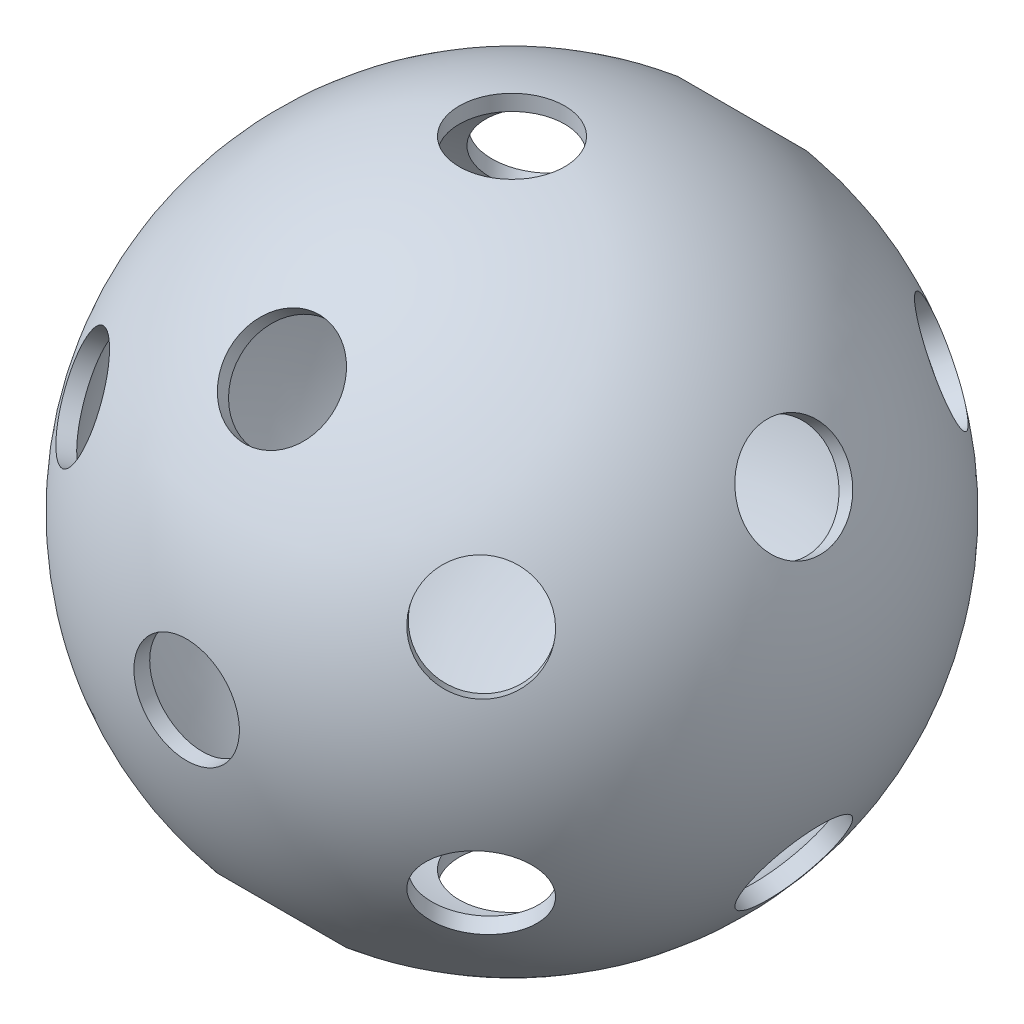
from build123d import *

# Parameters (mm, degrees)
SKETCH2_R                     = 10.16
CUT_EXTRUDE1_DEPTH            = 110.985226281
CIRPATTERN29_COUNT            = 8
CIRPATTERN30_COPY_1_SKETCH_R  = 10.16
CIRPATTERN30_COPY_1_DEPTH     = 110.985226281
CIRPATTERN30_COPY_2_SKETCH_R  = 10.16
CIRPATTERN30_COPY_2_DEPTH     = 110.985226281
CIRPATTERN30_COPY_3_SKETCH_R  = 10.16
CIRPATTERN30_COPY_3_DEPTH     = 110.985226281
CIRPATTERN30_COPY_4_SKETCH_R  = 10.16
CIRPATTERN30_COPY_4_DEPTH     = 110.985226281
CIRPATTERN30_COPY_5_SKETCH_R  = 10.16
CIRPATTERN30_COPY_5_DEPTH     = 110.985226281
CIRPATTERN30_COPY_6_SKETCH_R  = 10.16
CIRPATTERN30_COPY_6_DEPTH     = 110.985226281
CIRPATTERN30_COPY_7_SKETCH_R  = 10.16
CIRPATTERN30_COPY_7_DEPTH     = 110.985226281
CIRPATTERN30_COPY_8_SKETCH_R  = 10.16
CIRPATTERN30_COPY_8_DEPTH     = 110.985226281
CIRPATTERN30_COPY_9_SKETCH_R  = 10.16
CIRPATTERN30_COPY_9_DEPTH     = 110.985226281
CIRPATTERN30_COPY_10_SKETCH_R = 10.16
CIRPATTERN30_COPY_10_DEPTH    = 110.985226281
CIRPATTERN30_COPY_11_SKETCH_R = 10.16
CIRPATTERN30_COPY_11_DEPTH    = 110.985226281
CIRPATTERN30_COPY_12_SKETCH_R = 10.16
CIRPATTERN30_COPY_12_DEPTH    = 110.985226281
CIRPATTERN30_COPY_13_SKETCH_R = 10.16
CIRPATTERN30_COPY_13_DEPTH    = 110.985226281
CIRPATTERN30_COPY_14_SKETCH_R = 10.16
CIRPATTERN30_COPY_14_DEPTH    = 110.985226281
CIRPATTERN30_COPY_15_SKETCH_R = 10.16
CIRPATTERN30_COPY_15_DEPTH    = 110.985226281
CIRPATTERN30_COPY_16_SKETCH_R = 10.16
CIRPATTERN30_COPY_16_DEPTH    = 110.985226281
CIRPATTERN30_COPY_17_SKETCH_R = 10.16
CIRPATTERN30_COPY_17_DEPTH    = 110.985226281
CIRPATTERN30_COPY_18_SKETCH_R = 10.16
CIRPATTERN30_COPY_18_DEPTH    = 110.985226281
CIRPATTERN30_COPY_19_SKETCH_R = 10.16
CIRPATTERN30_COPY_19_DEPTH    = 110.985226281
CIRPATTERN30_COPY_20_SKETCH_R = 10.16
CIRPATTERN30_COPY_20_DEPTH    = 110.985226281
CIRPATTERN30_COPY_21_SKETCH_R = 10.16
CIRPATTERN30_COPY_21_DEPTH    = 110.985226281
CIRPATTERN30_COPY_22_SKETCH_R = 10.16
CIRPATTERN30_COPY_22_DEPTH    = 110.985226281
CIRPATTERN30_COPY_23_SKETCH_R = 10.16
CIRPATTERN30_COPY_23_DEPTH    = 110.985226281
CIRPATTERN30_COPY_24_SKETCH_R = 10.16
CIRPATTERN30_COPY_24_DEPTH    = 110.985226281
CIRPATTERN30_COPY_25_SKETCH_R = 10.16
CIRPATTERN30_COPY_25_DEPTH    = 110.985226281
CIRPATTERN30_COPY_26_SKETCH_R = 10.16
CIRPATTERN30_COPY_26_DEPTH    = 110.985226281
CIRPATTERN30_COPY_27_SKETCH_R = 10.16
CIRPATTERN30_COPY_27_DEPTH    = 110.985226281
CIRPATTERN30_COPY_28_SKETCH_R = 10.16
CIRPATTERN30_COPY_28_DEPTH    = 110.985226281
CIRPATTERN30_COPY_29_SKETCH_R = 10.16
CIRPATTERN30_COPY_29_DEPTH    = 110.985226281
CIRPATTERN30_COPY_30_SKETCH_R = 10.16
CIRPATTERN30_COPY_30_DEPTH    = 110.985226281
CIRPATTERN30_COPY_31_SKETCH_R = 10.16
CIRPATTERN30_COPY_31_DEPTH    = 110.985226281
CIRPATTERN30_COPY_32_SKETCH_R = 10.16
CIRPATTERN30_COPY_32_DEPTH    = 110.985226281
CIRPATTERN30_COPY_33_SKETCH_R = 10.16
CIRPATTERN30_COPY_33_DEPTH    = 110.985226281
CIRPATTERN30_COPY_34_SKETCH_R = 10.16
CIRPATTERN30_COPY_34_DEPTH    = 110.985226281
CIRPATTERN30_COPY_35_SKETCH_R = 10.16
CIRPATTERN30_COPY_35_DEPTH    = 110.985226281
CIRPATTERN30_COPY_36_SKETCH_R = 10.16
CIRPATTERN30_COPY_36_DEPTH    = 110.985226281
CIRPATTERN30_COPY_37_SKETCH_R = 10.16
CIRPATTERN30_COPY_37_DEPTH    = 110.985226281
CIRPATTERN30_COPY_38_SKETCH_R = 10.16
CIRPATTERN30_COPY_38_DEPTH    = 110.985226281
CIRPATTERN30_COPY_39_SKETCH_R = 10.16
CIRPATTERN30_COPY_39_DEPTH    = 110.985226281
CIRPATTERN30_COPY_40_SKETCH_R = 10.16
CIRPATTERN30_COPY_40_DEPTH    = 110.985226281


with BuildPart() as part:
    # Sketch1 → Revolve-Thin1 (revolve)
    with BuildSketch(Plane.XY):
        with BuildLine():
            ThreePointArc((0, 63.5), (63.5, 0), (0, -63.5))
            Line((0, -63.5), (0, -60.5))
            ThreePointArc((0, -60.5), (60.5, 0), (0, 60.5))
            Line((0, 60.5), (0, 63.5))
        make_face()
    revolve(axis=Axis((0, 63.5, 0), (0, -1, 0)))

    # Sketch2 → Cut-Extrude1 (cut, through all)
    with BuildSketch(Plane.XY):
        with Locations(Location((0, 0, 0), (0, 0, 180))):
            Circle(SKETCH2_R)
    cut_extrude1 = extrude(amount=CUT_EXTRUDE1_DEPTH, mode=Mode.SUBTRACT)

    # CirPattern29: Cut-Extrude1 ×8 about axis
    cirpattern29_axis = Axis((0, 0, 0), (-1, 0, 0))
    for i in range(1, CIRPATTERN29_COUNT):
        add(cut_extrude1.rotate(cirpattern29_axis, i * 360 / CIRPATTERN29_COUNT), mode=Mode.SUBTRACT)

    # CirPattern30 copy 1 sketch → CirPattern30 copy 1 (cut, through all)
    with BuildSketch(Plane(origin=(0, 0, 0), x_dir=(0.5000000000000002, -0.8660254037844386, 0), z_dir=(0.6123724356957945, 0.35355339059327384, 0.7071067811865476))):
        with Locations(Location((0, 0, 0), (0, 0, 180))):
            Circle(CIRPATTERN30_COPY_1_SKETCH_R)
    extrude(amount=CIRPATTERN30_COPY_1_DEPTH, mode=Mode.SUBTRACT)

    # CirPattern30 copy 2 sketch → CirPattern30 copy 2 (cut, through all)
    with BuildSketch(Plane(origin=(0, 0, 0), x_dir=(-0.4999999999999997, -0.8660254037844387, 0), z_dir=(0.6123724356957945, -0.3535533905932735, 0.7071067811865476))):
        with Locations(Location((0, 0, 0), (0, 0, 180))):
            Circle(CIRPATTERN30_COPY_2_SKETCH_R)
    extrude(amount=CIRPATTERN30_COPY_2_DEPTH, mode=Mode.SUBTRACT)

    # CirPattern30 copy 3 sketch → CirPattern30 copy 3 (cut, through all)
    with BuildSketch(Plane(origin=(0, 0, 0), x_dir=(-1, 0, 0), z_dir=(0, -0.7071067811865475, 0.7071067811865476))):
        with Locations(Location((0, 0, 0), (0, 0, 180))):
            Circle(CIRPATTERN30_COPY_3_SKETCH_R)
    extrude(amount=CIRPATTERN30_COPY_3_DEPTH, mode=Mode.SUBTRACT)

    # CirPattern30 copy 4 sketch → CirPattern30 copy 4 (cut, through all)
    with BuildSketch(Plane(origin=(0, 0, 0), x_dir=(-0.5000000000000006, 0.8660254037844384, 0), z_dir=(-0.6123724356957942, -0.3535533905932741, 0.7071067811865476))):
        with Locations(Location((0, 0, 0), (0, 0, 180))):
            Circle(CIRPATTERN30_COPY_4_SKETCH_R)
    extrude(amount=CIRPATTERN30_COPY_4_DEPTH, mode=Mode.SUBTRACT)

    # CirPattern30 copy 5 sketch → CirPattern30 copy 5 (cut, through all)
    with BuildSketch(Plane(origin=(0, 0, 0), x_dir=(0.5, 0.8660254037844386, 0), z_dir=(-0.6123724356957945, 0.35355339059327373, 0.7071067811865476))):
        with Locations(Location((0, 0, 0), (0, 0, 180))):
            Circle(CIRPATTERN30_COPY_5_SKETCH_R)
    extrude(amount=CIRPATTERN30_COPY_5_DEPTH, mode=Mode.SUBTRACT)

    # CirPattern30 copy 6 sketch → CirPattern30 copy 6 (cut, through all)
    with BuildSketch(Plane(origin=(0, 0, 0), x_dir=(0.5000000000000002, -0.8660254037844385, 0), z_dir=(0.8660254037844385, 0.5000000000000002, 0))):
        with Locations(Location((0, 0, 0), (0, 0, 180))):
            Circle(CIRPATTERN30_COPY_6_SKETCH_R)
    extrude(amount=CIRPATTERN30_COPY_6_DEPTH, mode=Mode.SUBTRACT)

    # CirPattern30 copy 7 sketch → CirPattern30 copy 7 (cut, through all)
    with BuildSketch(Plane(origin=(0, 0, 0), x_dir=(-0.49999999999999967, -0.8660254037844388, 0), z_dir=(0.8660254037844388, -0.49999999999999967, 0))):
        with Locations(Location((0, 0, 0), (0, 0, 180))):
            Circle(CIRPATTERN30_COPY_7_SKETCH_R)
    extrude(amount=CIRPATTERN30_COPY_7_DEPTH, mode=Mode.SUBTRACT)

    # CirPattern30 copy 8 sketch → CirPattern30 copy 8 (cut, through all)
    with BuildSketch(Plane(origin=(0, 0, 0), x_dir=(-1, 0, 0), z_dir=(0, -1, 0))):
        with Locations(Location((0, 0, 0), (0, 0, 180))):
            Circle(CIRPATTERN30_COPY_8_SKETCH_R)
    extrude(amount=CIRPATTERN30_COPY_8_DEPTH, mode=Mode.SUBTRACT)

    # CirPattern30 copy 9 sketch → CirPattern30 copy 9 (cut, through all)
    with BuildSketch(Plane(origin=(0, 0, 0), x_dir=(-0.5000000000000006, 0.8660254037844383, 0), z_dir=(-0.8660254037844383, -0.5000000000000006, 0))):
        with Locations(Location((0, 0, 0), (0, 0, 180))):
            Circle(CIRPATTERN30_COPY_9_SKETCH_R)
    extrude(amount=CIRPATTERN30_COPY_9_DEPTH, mode=Mode.SUBTRACT)

    # CirPattern30 copy 10 sketch → CirPattern30 copy 10 (cut, through all)
    with BuildSketch(Plane(origin=(0, 0, 0), x_dir=(0.5, 0.8660254037844387, 0), z_dir=(-0.8660254037844387, 0.5, 0))):
        with Locations(Location((0, 0, 0), (0, 0, 180))):
            Circle(CIRPATTERN30_COPY_10_SKETCH_R)
    extrude(amount=CIRPATTERN30_COPY_10_DEPTH, mode=Mode.SUBTRACT)

    # CirPattern30 copy 11 sketch → CirPattern30 copy 11 (cut, through all)
    with BuildSketch(Plane(origin=(0, 0, 0), x_dir=(0.5000000000000002, -0.8660254037844386, 0), z_dir=(0.6123724356957945, 0.353553390593274, -0.7071067811865475))):
        with Locations(Location((0, 0, 0), (0, 0, 180))):
            Circle(CIRPATTERN30_COPY_11_SKETCH_R)
    extrude(amount=CIRPATTERN30_COPY_11_DEPTH, mode=Mode.SUBTRACT)

    # CirPattern30 copy 12 sketch → CirPattern30 copy 12 (cut, through all)
    with BuildSketch(Plane(origin=(0, 0, 0), x_dir=(-0.4999999999999997, -0.8660254037844387, 0), z_dir=(0.6123724356957947, -0.35355339059327345, -0.7071067811865475))):
        with Locations(Location((0, 0, 0), (0, 0, 180))):
            Circle(CIRPATTERN30_COPY_12_SKETCH_R)
    extrude(amount=CIRPATTERN30_COPY_12_DEPTH, mode=Mode.SUBTRACT)

    # CirPattern30 copy 13 sketch → CirPattern30 copy 13 (cut, through all)
    with BuildSketch(Plane(origin=(0, 0, 0), x_dir=(-1, 0, 0), z_dir=(0, -0.7071067811865476, -0.7071067811865475))):
        with Locations(Location((0, 0, 0), (0, 0, 180))):
            Circle(CIRPATTERN30_COPY_13_SKETCH_R)
    extrude(amount=CIRPATTERN30_COPY_13_DEPTH, mode=Mode.SUBTRACT)

    # CirPattern30 copy 14 sketch → CirPattern30 copy 14 (cut, through all)
    with BuildSketch(Plane(origin=(0, 0, 0), x_dir=(-0.5000000000000006, 0.8660254037844384, 0), z_dir=(-0.6123724356957942, -0.3535533905932743, -0.7071067811865475))):
        with Locations(Location((0, 0, 0), (0, 0, 180))):
            Circle(CIRPATTERN30_COPY_14_SKETCH_R)
    extrude(amount=CIRPATTERN30_COPY_14_DEPTH, mode=Mode.SUBTRACT)

    # CirPattern30 copy 15 sketch → CirPattern30 copy 15 (cut, through all)
    with BuildSketch(Plane(origin=(0, 0, 0), x_dir=(0.5, 0.8660254037844386, 0), z_dir=(-0.6123724356957947, 0.3535533905932737, -0.7071067811865475))):
        with Locations(Location((0, 0, 0), (0, 0, 180))):
            Circle(CIRPATTERN30_COPY_15_SKETCH_R)
    extrude(amount=CIRPATTERN30_COPY_15_DEPTH, mode=Mode.SUBTRACT)

    # CirPattern30 copy 16 sketch → CirPattern30 copy 16 (cut, through all)
    with BuildSketch(Plane(origin=(0, 0, 0), x_dir=(0.5000000000000001, -0.8660254037844386, 0), z_dir=(0, 0, -1))):
        with Locations(Location((0, 0, 0), (0, 0, 180))):
            Circle(CIRPATTERN30_COPY_16_SKETCH_R)
    extrude(amount=CIRPATTERN30_COPY_16_DEPTH, mode=Mode.SUBTRACT)

    # CirPattern30 copy 17 sketch → CirPattern30 copy 17 (cut, through all)
    with BuildSketch(Plane(origin=(0, 0, 0), x_dir=(-0.4999999999999998, -0.8660254037844387, 0), z_dir=(0, 0, -1))):
        with Locations(Location((0, 0, 0), (0, 0, 180))):
            Circle(CIRPATTERN30_COPY_17_SKETCH_R)
    extrude(amount=CIRPATTERN30_COPY_17_DEPTH, mode=Mode.SUBTRACT)

    # CirPattern30 copy 18 sketch → CirPattern30 copy 18 (cut, through all)
    with BuildSketch(Plane(origin=(0, 0, 0), x_dir=(-1, 0, 0), z_dir=(0, 0, -1))):
        with Locations(Location((0, 0, 0), (0, 0, 180))):
            Circle(CIRPATTERN30_COPY_18_SKETCH_R)
    extrude(amount=CIRPATTERN30_COPY_18_DEPTH, mode=Mode.SUBTRACT)

    # CirPattern30 copy 19 sketch → CirPattern30 copy 19 (cut, through all)
    with BuildSketch(Plane(origin=(0, 0, 0), x_dir=(-0.5000000000000004, 0.8660254037844384, 0), z_dir=(0, 0, -1))):
        with Locations(Location((0, 0, 0), (0, 0, 180))):
            Circle(CIRPATTERN30_COPY_19_SKETCH_R)
    extrude(amount=CIRPATTERN30_COPY_19_DEPTH, mode=Mode.SUBTRACT)

    # CirPattern30 copy 20 sketch → CirPattern30 copy 20 (cut, through all)
    with BuildSketch(Plane(origin=(0, 0, 0), x_dir=(0.5000000000000001, 0.8660254037844386, 0), z_dir=(0, 0, -1))):
        with Locations(Location((0, 0, 0), (0, 0, 180))):
            Circle(CIRPATTERN30_COPY_20_SKETCH_R)
    extrude(amount=CIRPATTERN30_COPY_20_DEPTH, mode=Mode.SUBTRACT)

    # CirPattern30 copy 21 sketch → CirPattern30 copy 21 (cut, through all)
    with BuildSketch(Plane(origin=(0, 0, 0), x_dir=(0.5, -0.8660254037844386, 0), z_dir=(-0.6123724356957946, -0.3535533905932736, -0.7071067811865477))):
        with Locations(Location((0, 0, 0), (0, 0, 180))):
            Circle(CIRPATTERN30_COPY_21_SKETCH_R)
    extrude(amount=CIRPATTERN30_COPY_21_DEPTH, mode=Mode.SUBTRACT)

    # CirPattern30 copy 22 sketch → CirPattern30 copy 22 (cut, through all)
    with BuildSketch(Plane(origin=(0, 0, 0), x_dir=(-0.49999999999999983, -0.8660254037844387, 0), z_dir=(-0.6123724356957944, 0.35355339059327373, -0.7071067811865477))):
        with Locations(Location((0, 0, 0), (0, 0, 180))):
            Circle(CIRPATTERN30_COPY_22_SKETCH_R)
    extrude(amount=CIRPATTERN30_COPY_22_DEPTH, mode=Mode.SUBTRACT)

    # CirPattern30 copy 23 sketch → CirPattern30 copy 23 (cut, through all)
    with BuildSketch(Plane(origin=(0, 0, 0), x_dir=(-1, 0, 0), z_dir=(0, 0.7071067811865475, -0.7071067811865477))):
        with Locations(Location((0, 0, 0), (0, 0, 180))):
            Circle(CIRPATTERN30_COPY_23_SKETCH_R)
    extrude(amount=CIRPATTERN30_COPY_23_DEPTH, mode=Mode.SUBTRACT)

    # CirPattern30 copy 24 sketch → CirPattern30 copy 24 (cut, through all)
    with BuildSketch(Plane(origin=(0, 0, 0), x_dir=(-0.5000000000000003, 0.8660254037844384, 0), z_dir=(0.6123724356957944, 0.3535533905932739, -0.7071067811865477))):
        with Locations(Location((0, 0, 0), (0, 0, 180))):
            Circle(CIRPATTERN30_COPY_24_SKETCH_R)
    extrude(amount=CIRPATTERN30_COPY_24_DEPTH, mode=Mode.SUBTRACT)

    # CirPattern30 copy 25 sketch → CirPattern30 copy 25 (cut, through all)
    with BuildSketch(Plane(origin=(0, 0, 0), x_dir=(0.5000000000000002, 0.8660254037844386, 0), z_dir=(0.6123724356957944, -0.35355339059327395, -0.7071067811865477))):
        with Locations(Location((0, 0, 0), (0, 0, 180))):
            Circle(CIRPATTERN30_COPY_25_SKETCH_R)
    extrude(amount=CIRPATTERN30_COPY_25_DEPTH, mode=Mode.SUBTRACT)

    # CirPattern30 copy 26 sketch → CirPattern30 copy 26 (cut, through all)
    with BuildSketch(Plane(origin=(0, 0, 0), x_dir=(0.5, -0.8660254037844387, 0), z_dir=(-0.8660254037844387, -0.5, 0))):
        with Locations(Location((0, 0, 0), (0, 0, 180))):
            Circle(CIRPATTERN30_COPY_26_SKETCH_R)
    extrude(amount=CIRPATTERN30_COPY_26_DEPTH, mode=Mode.SUBTRACT)

    # CirPattern30 copy 27 sketch → CirPattern30 copy 27 (cut, through all)
    with BuildSketch(Plane(origin=(0, 0, 0), x_dir=(-0.4999999999999999, -0.8660254037844386, 0), z_dir=(-0.8660254037844386, 0.4999999999999999, 0))):
        with Locations(Location((0, 0, 0), (0, 0, 180))):
            Circle(CIRPATTERN30_COPY_27_SKETCH_R)
    extrude(amount=CIRPATTERN30_COPY_27_DEPTH, mode=Mode.SUBTRACT)

    # CirPattern30 copy 28 sketch → CirPattern30 copy 28 (cut, through all)
    with BuildSketch(Plane(origin=(0, 0, 0), x_dir=(-1, 0, 0), z_dir=(0, 1, 0))):
        with Locations(Location((0, 0, 0), (0, 0, 180))):
            Circle(CIRPATTERN30_COPY_28_SKETCH_R)
    extrude(amount=CIRPATTERN30_COPY_28_DEPTH, mode=Mode.SUBTRACT)

    # CirPattern30 copy 29 sketch → CirPattern30 copy 29 (cut, through all)
    with BuildSketch(Plane(origin=(0, 0, 0), x_dir=(-0.5000000000000003, 0.8660254037844385, 0), z_dir=(0.8660254037844385, 0.5000000000000003, 0))):
        with Locations(Location((0, 0, 0), (0, 0, 180))):
            Circle(CIRPATTERN30_COPY_29_SKETCH_R)
    extrude(amount=CIRPATTERN30_COPY_29_DEPTH, mode=Mode.SUBTRACT)

    # CirPattern30 copy 30 sketch → CirPattern30 copy 30 (cut, through all)
    with BuildSketch(Plane(origin=(0, 0, 0), x_dir=(0.5000000000000002, 0.8660254037844385, 0), z_dir=(0.8660254037844385, -0.5000000000000002, 0))):
        with Locations(Location((0, 0, 0), (0, 0, 180))):
            Circle(CIRPATTERN30_COPY_30_SKETCH_R)
    extrude(amount=CIRPATTERN30_COPY_30_DEPTH, mode=Mode.SUBTRACT)

    # CirPattern30 copy 31 sketch → CirPattern30 copy 31 (cut, through all)
    with BuildSketch(Plane(origin=(0, 0, 0), x_dir=(0.5, -0.8660254037844386, 0), z_dir=(-0.6123724356957946, -0.35355339059327384, 0.7071067811865474))):
        with Locations(Location((0, 0, 0), (0, 0, 180))):
            Circle(CIRPATTERN30_COPY_31_SKETCH_R)
    extrude(amount=CIRPATTERN30_COPY_31_DEPTH, mode=Mode.SUBTRACT)

    # CirPattern30 copy 32 sketch → CirPattern30 copy 32 (cut, through all)
    with BuildSketch(Plane(origin=(0, 0, 0), x_dir=(-0.49999999999999983, -0.8660254037844387, 0), z_dir=(-0.6123724356957947, 0.35355339059327373, 0.7071067811865474))):
        with Locations(Location((0, 0, 0), (0, 0, 180))):
            Circle(CIRPATTERN30_COPY_32_SKETCH_R)
    extrude(amount=CIRPATTERN30_COPY_32_DEPTH, mode=Mode.SUBTRACT)

    # CirPattern30 copy 33 sketch → CirPattern30 copy 33 (cut, through all)
    with BuildSketch(Plane(origin=(0, 0, 0), x_dir=(-1, 0, 0), z_dir=(0, 0.7071067811865477, 0.7071067811865474))):
        with Locations(Location((0, 0, 0), (0, 0, 180))):
            Circle(CIRPATTERN30_COPY_33_SKETCH_R)
    extrude(amount=CIRPATTERN30_COPY_33_DEPTH, mode=Mode.SUBTRACT)

    # CirPattern30 copy 34 sketch → CirPattern30 copy 34 (cut, through all)
    with BuildSketch(Plane(origin=(0, 0, 0), x_dir=(-0.5000000000000003, 0.8660254037844384, 0), z_dir=(0.6123724356957945, 0.3535533905932741, 0.7071067811865474))):
        with Locations(Location((0, 0, 0), (0, 0, 180))):
            Circle(CIRPATTERN30_COPY_34_SKETCH_R)
    extrude(amount=CIRPATTERN30_COPY_34_DEPTH, mode=Mode.SUBTRACT)

    # CirPattern30 copy 35 sketch → CirPattern30 copy 35 (cut, through all)
    with BuildSketch(Plane(origin=(0, 0, 0), x_dir=(0.5000000000000002, 0.8660254037844386, 0), z_dir=(0.6123724356957946, -0.35355339059327395, 0.7071067811865474))):
        with Locations(Location((0, 0, 0), (0, 0, 180))):
            Circle(CIRPATTERN30_COPY_35_SKETCH_R)
    extrude(amount=CIRPATTERN30_COPY_35_DEPTH, mode=Mode.SUBTRACT)

    # CirPattern30 copy 36 sketch → CirPattern30 copy 36 (cut, through all)
    with BuildSketch(Plane(origin=(0, 0, 0), x_dir=(0.5000000000000001, -0.8660254037844386, 0), z_dir=(0, 0, 1))):
        with Locations(Location((0, 0, 0), (0, 0, 180))):
            Circle(CIRPATTERN30_COPY_36_SKETCH_R)
    extrude(amount=CIRPATTERN30_COPY_36_DEPTH, mode=Mode.SUBTRACT)

    # CirPattern30 copy 37 sketch → CirPattern30 copy 37 (cut, through all)
    with BuildSketch(Plane(origin=(0, 0, 0), x_dir=(-0.4999999999999998, -0.8660254037844387, 0), z_dir=(0, 0, 1))):
        with Locations(Location((0, 0, 0), (0, 0, 180))):
            Circle(CIRPATTERN30_COPY_37_SKETCH_R)
    extrude(amount=CIRPATTERN30_COPY_37_DEPTH, mode=Mode.SUBTRACT)

    # CirPattern30 copy 38 sketch → CirPattern30 copy 38 (cut, through all)
    with BuildSketch(Plane(origin=(0, 0, 0), x_dir=(-1, 0, 0), z_dir=(0, 0, 1))):
        with Locations(Location((0, 0, 0), (0, 0, 180))):
            Circle(CIRPATTERN30_COPY_38_SKETCH_R)
    extrude(amount=CIRPATTERN30_COPY_38_DEPTH, mode=Mode.SUBTRACT)

    # CirPattern30 copy 39 sketch → CirPattern30 copy 39 (cut, through all)
    with BuildSketch(Plane(origin=(0, 0, 0), x_dir=(-0.5000000000000004, 0.8660254037844384, 0), z_dir=(0, 0, 1))):
        with Locations(Location((0, 0, 0), (0, 0, 180))):
            Circle(CIRPATTERN30_COPY_39_SKETCH_R)
    extrude(amount=CIRPATTERN30_COPY_39_DEPTH, mode=Mode.SUBTRACT)

    # CirPattern30 copy 40 sketch → CirPattern30 copy 40 (cut, through all)
    with BuildSketch(Plane(origin=(0, 0, 0), x_dir=(0.5000000000000001, 0.8660254037844386, 0), z_dir=(0, 0, 1))):
        with Locations(Location((0, 0, 0), (0, 0, 180))):
            Circle(CIRPATTERN30_COPY_40_SKETCH_R)
    extrude(amount=CIRPATTERN30_COPY_40_DEPTH, mode=Mode.SUBTRACT)


solid = part.part
